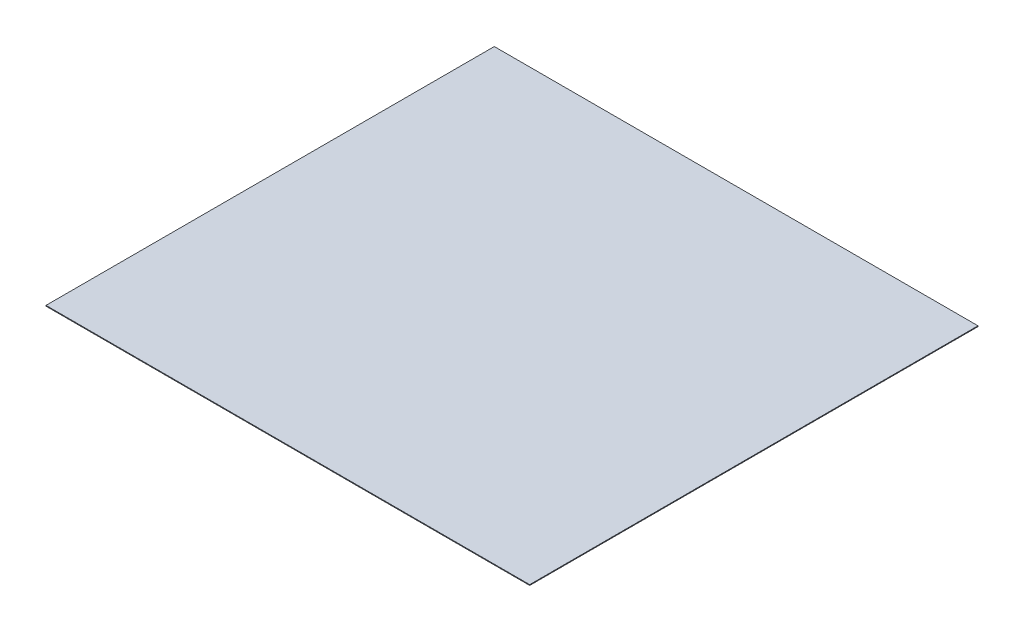
from build123d import *

# Parameters (mm, degrees)
SKETCH1_W           = 2082.8
SKETCH1_H           = 1930.4
BOSS_EXTRUDE1_DEPTH = 3.175


with BuildPart() as part:
    # Sketch1 → Boss-Extrude1 (new body)
    with BuildSketch(Plane(origin=(0, 0, 0), x_dir=(1, 0, 0), z_dir=(0, 1, 0))):
        with Locations((-240.782817798, 47.954699334)):
            Rectangle(SKETCH1_W, SKETCH1_H)
    extrude(amount=BOSS_EXTRUDE1_DEPTH)


solid = part.part
